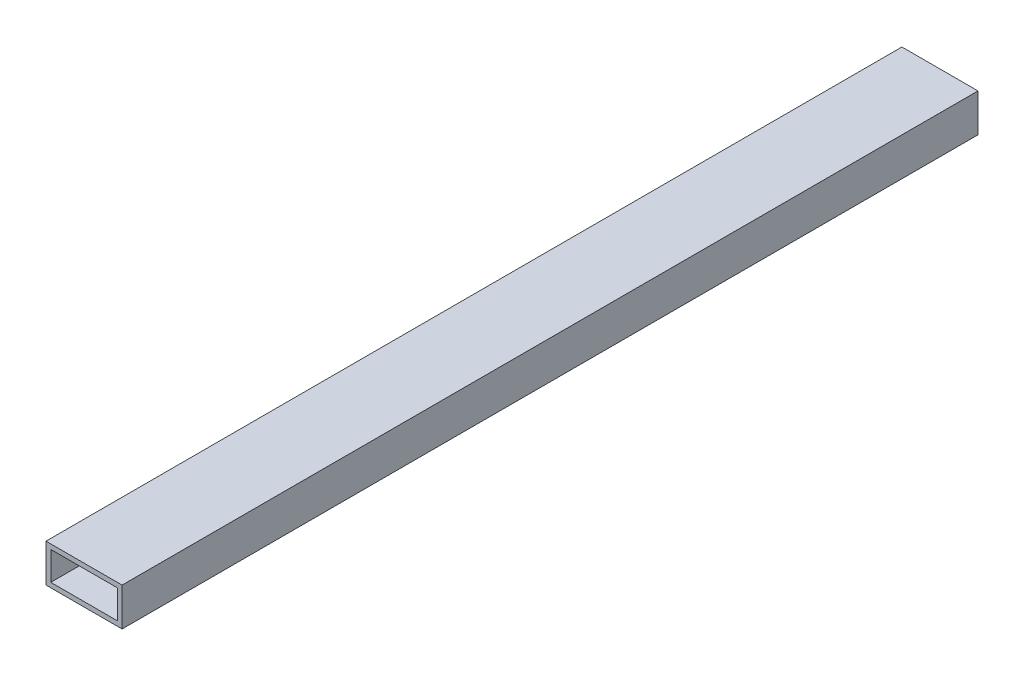
from build123d import *

# Parameters (mm, degrees)
SKETCH1_W           = 40
SKETCH1_H           = 20
SKETCH1_W_2         = 35
SKETCH1_H_2         = 15
BOSS_EXTRUDE1_DEPTH = 225


with BuildPart() as part:
    # Sketch1 → Boss-Extrude1 (new, symmetric)
    with BuildSketch(Plane.XY):
        Rectangle(SKETCH1_W, SKETCH1_H)
        Rectangle(SKETCH1_W_2, SKETCH1_H_2, mode=Mode.SUBTRACT)
    extrude(amount=BOSS_EXTRUDE1_DEPTH, both=True)


solid = part.part
